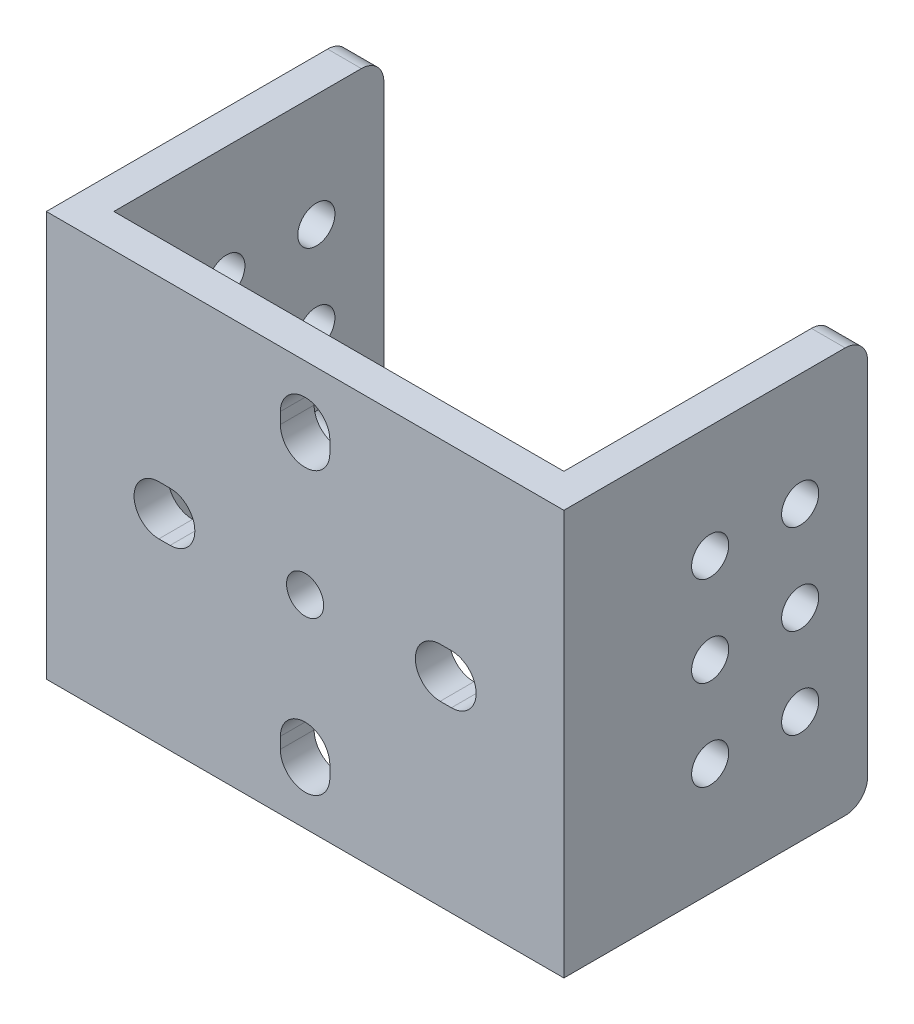
from build123d import *

# Parameters (mm, degrees)
SKETCH_1_W          = 46
SKETCH_1_H          = 36
SKETCH_1_R          = 1.65
EXTRUDE_1_DEPTH     = 3
SKETCH_2_W          = 3
SKETCH_2_H          = 36
EXTRUDE_2_DEPTH     = 24
SKETCH_3_R          = 1.65
CUT_EXTRUDE_1_DEPTH = 50
FILLET_1_R          = 2


with BuildPart() as part:
    # 草图1 → 凸台-拉伸1 (new body)
    with BuildSketch(Plane.XY):
        with Locations((23, 18)):
            Rectangle(SKETCH_1_W, SKETCH_1_H)
        with BuildLine():
            Line((20.8, 30), (20.8, 31))
            ThreePointArc((20.8, 31), (23, 33.2), (25.2, 31))
            Line((25.2, 31), (25.2, 30))
            ThreePointArc((25.2, 30), (23, 27.8), (20.8, 30))
        make_face(mode=Mode.SUBTRACT)
        with BuildLine():
            ThreePointArc((36, 20.2), (38.2, 18), (36, 15.8))
            Line((36, 15.8), (35, 15.8))
            ThreePointArc((35, 15.8), (32.8, 18), (35, 20.2))
            Line((35, 20.2), (36, 20.2))
        make_face(mode=Mode.SUBTRACT)
        with BuildLine():
            ThreePointArc((25.2, 5), (23, 2.8), (20.8, 5))
            Line((20.8, 5), (20.8, 6))
            ThreePointArc((20.8, 6), (23, 8.2), (25.2, 6))
            Line((25.2, 6), (25.2, 5))
        make_face(mode=Mode.SUBTRACT)
        with BuildLine():
            ThreePointArc((10, 15.8), (7.8, 18), (10, 20.2))
            Line((10, 20.2), (11, 20.2))
            ThreePointArc((11, 20.2), (13.2, 18), (11, 15.8))
            Line((11, 15.8), (10, 15.8))
        make_face(mode=Mode.SUBTRACT)
        with Locations((23, 18)):
            Circle(SKETCH_1_R, mode=Mode.SUBTRACT)
    extrude(amount=EXTRUDE_1_DEPTH)

    # 草图2 → 凸台-拉伸2 (add)
    with BuildSketch(Plane.XY):
        with Locations((1.5, 18)):
            Rectangle(SKETCH_2_W, SKETCH_2_H)
        with Locations((44.5, 18)):
            Rectangle(SKETCH_2_W, SKETCH_2_H)
    extrude(amount=-EXTRUDE_2_DEPTH)

    # 草图3 → 切除-拉伸1 (cut)
    with BuildSketch(Plane(origin=(46, 0, 0), x_dir=(0, 0, -1), z_dir=(1, 0, 0))):
        with Locations((18, 10)):
            Circle(SKETCH_3_R)
        with Locations((10, 18)):
            Circle(SKETCH_3_R)
        with Locations((10, 10)):
            Circle(SKETCH_3_R)
        with Locations((18, 26)):
            Circle(SKETCH_3_R)
        with Locations((18, 18)):
            Circle(SKETCH_3_R)
        with Locations((10, 26)):
            Circle(SKETCH_3_R)
    extrude(amount=-CUT_EXTRUDE_1_DEPTH, mode=Mode.SUBTRACT)

    # 圆角1
    fillet_1_edges = [part.edges().sort_by_distance(p)[0] for p in [
        (1.5, 36, -24),
        (1.5, 0, -24),
        (44.5, 0, -24),
        (44.5, 36, -24),
    ]]
    fillet(fillet_1_edges, radius=FILLET_1_R)


solid = part.part
